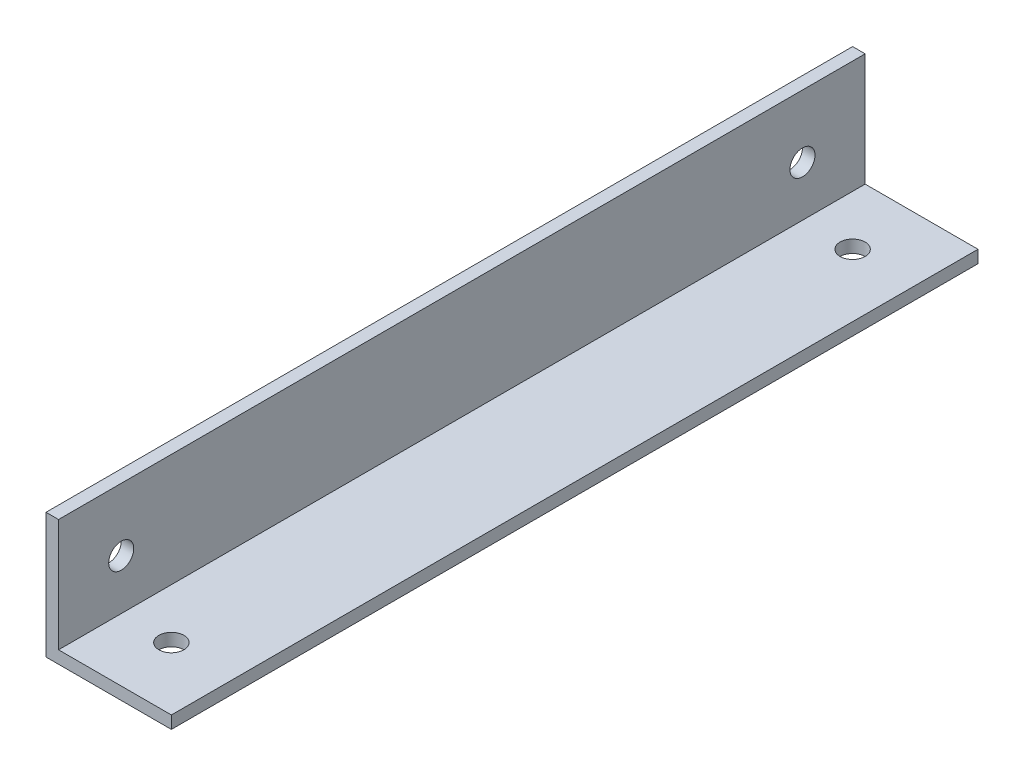
from build123d import *

# Parameters (mm, degrees)
EXTRUSION1_DEPTH = 96.5
ESQUISSE2_R      = 1.5
EXTRUSION2_DEPTH = 98
ESQUISSE3_R      = 1.5
EXTRUSION3_DEPTH = 98


with BuildPart() as part:
    # Esquisse1 → Extrusion1 (new body)
    with BuildSketch(Plane.XY):
        Polygon((-19.573013681, -1.563756614), (-19.573013681, -16.563756614), (-4.573013681, -16.563756614), (-4.573013681, -15.063756614), (-18.073013681, -15.063756614), (-18.073013681, -1.563756614), align=None)
    extrude(amount=EXTRUSION1_DEPTH)

    # Esquisse2 → Extrusion2 (cut)
    with BuildSketch(Plane.XZ.offset(16.563756614)):
        with Locations(Location((-12.073013681, 89, 0), (0, 0, 270))):
            Circle(ESQUISSE2_R)
        with Locations(Location((-12.073013681, 7.5, 0), (0, 0, 270))):
            Circle(ESQUISSE2_R)
    extrude(amount=-EXTRUSION2_DEPTH, mode=Mode.SUBTRACT)

    # Esquisse3 → Extrusion3 (cut)
    with BuildSketch(Plane.ZY.offset(19.573013681)):
        with Locations(Location((89, -9.063756614, 0), (0, 0, 270))):
            Circle(ESQUISSE3_R)
        with Locations(Location((7.5, -9.063756614, 0), (0, 0, 270))):
            Circle(ESQUISSE3_R)
    extrude(amount=-EXTRUSION3_DEPTH, mode=Mode.SUBTRACT)


solid = part.part
